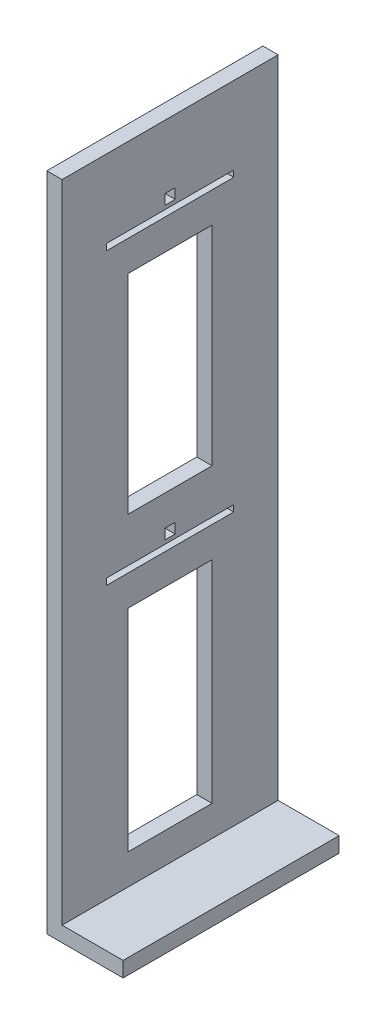
from build123d import *

# Parameters (mm, degrees)
SKETCH1_W           = 6
SKETCH1_H           = 17
BOSS_EXTRUDE1_DEPTH = 1.2
SKETCH2_W           = 2
SKETCH2_H           = 17
BOSS_EXTRUDE2_DEPTH = 68
CUT_EXTRUDE1_REACH  = 72.337
SKETCH3_W           = 0.8
SKETCH3_H           = 0.8
SKETCH3_W_2         = 10
SKETCH3_H_2         = 0.5
CUT_EXTRUDE3_REACH  = 72.337
SKETCH4_W           = 17
SKETCH4_H           = 17.2
SKETCH4_W_2         = 6.6
SKETCH4_H_2         = 16.4
SKETCH4_H_3         = 16.6
CUT_EXTRUDE4_REACH  = 61.352
SKETCH5_W           = 0.8
SKETCH5_H           = 17


with BuildPart() as part:
    # Sketch1 → Boss-Extrude1 (new body)
    with BuildSketch(Plane(origin=(0, 0, 0), x_dir=(1, 0, 0), z_dir=(0, 1, 0))):
        with Locations((-23, 3.444444444)):
            Rectangle(SKETCH1_W, SKETCH1_H)
    extrude(amount=BOSS_EXTRUDE1_DEPTH)

    # Sketch2 → Boss-Extrude2 (add)
    with BuildSketch(Plane(origin=(0, 1.2, 0), x_dir=(1, 0, 0), z_dir=(0, 1, 0))):
        with Locations((-25, 3.444444444)):
            Rectangle(SKETCH2_W, SKETCH2_H)
    extrude(amount=BOSS_EXTRUDE2_DEPTH)

    # Sketch3 → Cut-Extrude1 (cut, up to next)
    with BuildSketch(Plane(origin=(-24, 0, 0), x_dir=(0, 0, -1), z_dir=(1, 0, 0)), mode=Mode.PRIVATE) as cut_extrude1_sk1:
        with Locations((3.444444444, 23.8)):
            Rectangle(SKETCH3_W, SKETCH3_H)
    cut_extrude1_tool1 = extrude(cut_extrude1_sk1.sketch, amount=-CUT_EXTRUDE1_REACH, mode=Mode.PRIVATE) & part.part
    # Sketch3 → Cut-Extrude1 (cut, up to next)
    with BuildSketch(Plane(origin=(-24, 0, 0), x_dir=(0, 0, -1), z_dir=(1, 0, 0)), mode=Mode.PRIVATE) as cut_extrude1_sk2:
        with Locations((3.444444444, 46.6)):
            Rectangle(SKETCH3_W, SKETCH3_H)
    cut_extrude1_tool2 = extrude(cut_extrude1_sk2.sketch, amount=-CUT_EXTRUDE1_REACH, mode=Mode.PRIVATE) & part.part
    # Sketch3 → Cut-Extrude1 (cut, up to next)
    with BuildSketch(Plane(origin=(-24, 0, 0), x_dir=(0, 0, -1), z_dir=(1, 0, 0)), mode=Mode.PRIVATE) as cut_extrude1_sk3:
        with Locations((3.444444444, 22.85)):
            Rectangle(SKETCH3_W_2, SKETCH3_H_2)
    cut_extrude1_tool3 = extrude(cut_extrude1_sk3.sketch, amount=-CUT_EXTRUDE1_REACH, mode=Mode.PRIVATE) & part.part
    # Sketch3 → Cut-Extrude1 (cut, up to next)
    with BuildSketch(Plane(origin=(-24, 0, 0), x_dir=(0, 0, -1), z_dir=(1, 0, 0)), mode=Mode.PRIVATE) as cut_extrude1_sk4:
        with Locations((3.444444444, 45.65)):
            Rectangle(SKETCH3_W_2, SKETCH3_H_2)
    cut_extrude1_tool4 = extrude(cut_extrude1_sk4.sketch, amount=-CUT_EXTRUDE1_REACH, mode=Mode.PRIVATE) & part.part
    add(cut_extrude1_tool1.solids().sort_by_distance((-24, 23.8, -3.444444))[0], mode=Mode.SUBTRACT)
    add(cut_extrude1_tool2.solids().sort_by_distance((-24, 46.6, -3.444444))[0], mode=Mode.SUBTRACT)
    add(cut_extrude1_tool3.solids().sort_by_distance((-24, 22.85, -3.444444))[0], mode=Mode.SUBTRACT)
    add(cut_extrude1_tool4.solids().sort_by_distance((-24, 45.65, -3.444444))[0], mode=Mode.SUBTRACT)

    # Sketch4 → Cut-Extrude3 (cut, up to next)
    with BuildSketch(Plane(origin=(-24, 0, 0), x_dir=(0, 0, -1), z_dir=(1, 0, 0)), mode=Mode.PRIVATE) as cut_extrude3_sk1:
        with Locations((3.444444444, 60.6)):
            Rectangle(SKETCH4_W, SKETCH4_H)
    cut_extrude3_tool1 = extrude(cut_extrude3_sk1.sketch, amount=-CUT_EXTRUDE3_REACH, mode=Mode.PRIVATE) & part.part
    # Sketch4 → Cut-Extrude3 (cut, up to next)
    with BuildSketch(Plane(origin=(-24, 0, 0), x_dir=(0, 0, -1), z_dir=(1, 0, 0)), mode=Mode.PRIVATE) as cut_extrude3_sk2:
        with Locations((3.444444444, 34.8)):
            Rectangle(SKETCH4_W_2, SKETCH4_H_2)
    cut_extrude3_tool2 = extrude(cut_extrude3_sk2.sketch, amount=-CUT_EXTRUDE3_REACH, mode=Mode.PRIVATE) & part.part
    # Sketch4 → Cut-Extrude3 (cut, up to next)
    with BuildSketch(Plane(origin=(-24, 0, 0), x_dir=(0, 0, -1), z_dir=(1, 0, 0)), mode=Mode.PRIVATE) as cut_extrude3_sk3:
        with Locations((3.444444444, 11.9)):
            Rectangle(SKETCH4_W_2, SKETCH4_H_3)
    cut_extrude3_tool3 = extrude(cut_extrude3_sk3.sketch, amount=-CUT_EXTRUDE3_REACH, mode=Mode.PRIVATE) & part.part
    add(cut_extrude3_tool1.solids().sort_by_distance((-24, 60.6, -3.444444))[0], mode=Mode.SUBTRACT)
    add(cut_extrude3_tool2.solids().sort_by_distance((-24, 34.8, -3.444444))[0], mode=Mode.SUBTRACT)
    add(cut_extrude3_tool3.solids().sort_by_distance((-24, 11.9, -3.444444))[0], mode=Mode.SUBTRACT)

    # Cut-Extrude4: up to this face of the body (flat: up to its plane)
    cut_extrude4_end = Plane(part.part.faces().sort_by_distance((-22, 1.2, -3.444444444))[0])
    # Sketch5 → Cut-Extrude4 (cut, up to the picked face)
    with BuildSketch(Plane(origin=(0, 52, 0), x_dir=(1, 0, 0), z_dir=(0, 1, 0)), mode=Mode.PRIVATE) as cut_extrude4_sk1:
        with Locations((-24.4, 3.444444444)):
            Rectangle(SKETCH5_W, SKETCH5_H)
    cut_extrude4_tool1 = split(extrude(cut_extrude4_sk1.sketch, amount=-CUT_EXTRUDE4_REACH, mode=Mode.PRIVATE), bisect_by=cut_extrude4_end, keep=Keep.BOTH, mode=Mode.PRIVATE)
    add(cut_extrude4_tool1.solids().sort_by(Axis((-24.4, 52, -3.444444), (0, -1, 0)))[0], mode=Mode.SUBTRACT)


solid = part.part
